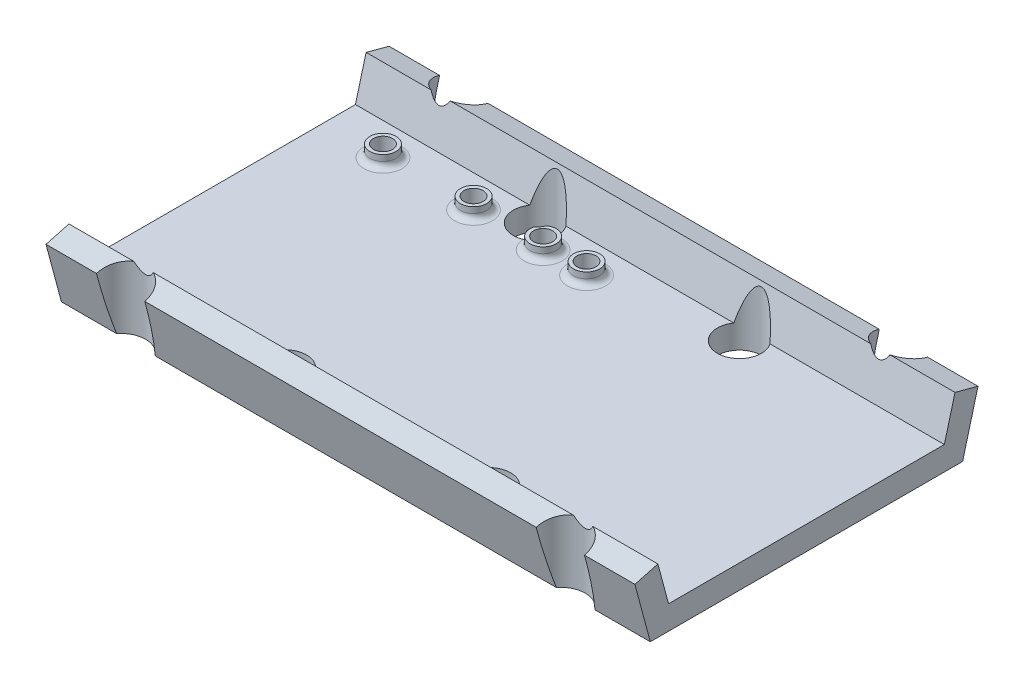
from build123d import *

# Parameters (mm, degrees)
SKETCH2_W                  = 99
SKETCH2_H                  = 52.5
FLATTEMPLATE_DEPTH         = 4
SIDEWALLS_DEPTH            = 99
INNERHOLESCUT_DEPTH        = 58.677621483
INNERHOLESCUT_DEPTH_BACK   = 58.677621483
INNERHOLES_R               = 1
OUTERHOLESCUT_DEPTH        = 58.677621483
OUTERHOLESCUT_DEPTH_BACK   = 58.677621483
TOPOUTERHOLES_R            = 4.064
TARGETHOLES_R              = 2.2
TARGETHOLESUPPORTS_DEPTH   = 2
TARGETHOLEFILLETS_R        = 1
TARGETHOLEHOLES_DEPTH      = 58.677621483
TARGETHOLEHOLES_DEPTH_BACK = 58.677621483
SKETCH10_R                 = 1.6
INNERHOLESRECUT_DEPTH      = 58.677621483
INNERHOLESRECUT_DEPTH_BACK = 58.677621483
SKETCH11_R                 = 3.7


with BuildPart() as part:
    # Sketch2 → FlatTemplate (new body)
    with BuildSketch(Plane(origin=(0, 0, 0), x_dir=(1, 0, 0), z_dir=(0, 1, 0))):
        Rectangle(SKETCH2_W, SKETCH2_H)
    extrude(amount=FLATTEMPLATE_DEPTH)

    # Sketch4 → SideWalls (add, through all)
    with BuildSketch(Plane(origin=(49.5, 0, 0), x_dir=(0, 0, -1), z_dir=(1, 0, 0))):
        Polygon((-26.25, 0), (-28.838190451, 9.659258263), (-24.974487146, 10.694534443), (-22.386296695, 1.03527618), align=None)
        Polygon((26.25, 0), (28.838190451, 9.659258263), (24.974487146, 10.694534443), (22.386296695, 1.03527618), align=None)
    extrude(amount=-SIDEWALLS_DEPTH)

    # InnerHoles → InnerHolesCut (cut, two sides: drawn at the far end of the back side and taken through both)
    with BuildSketch(Plane(origin=(0, 4, 0), x_dir=(1, 0, 0), z_dir=(0, 1, 0)).offset(-INNERHOLESCUT_DEPTH_BACK)):
        with Locations(Location((-17.15, 21.082, 0), (0, 0, 270))):
            Circle(INNERHOLES_R)
        with Locations(Location((17.15, 21.082, 0), (0, 0, 270))):
            Circle(INNERHOLES_R)
        with Locations(Location((17.15, -21.082, 0), (0, 0, 270))):
            Circle(INNERHOLES_R)
        with Locations(Location((-17.15, -21.082, 0), (0, 0, 270))):
            Circle(INNERHOLES_R)
    extrude(amount=INNERHOLESCUT_DEPTH + INNERHOLESCUT_DEPTH_BACK, mode=Mode.SUBTRACT)

    # TopOuterHoles → OuterHolesCut (cut, two sides: drawn at the far end of the back side and taken through both)
    with BuildSketch(Plane(origin=(0, 4, 0), x_dir=(1, 0, 0), z_dir=(0, 1, 0)).offset(-OUTERHOLESCUT_DEPTH_BACK)):
        with Locations((-36.96, 28.7)):
            Circle(TOPOUTERHOLES_R)
        with Locations((36.96, 28.7)):
            Circle(TOPOUTERHOLES_R)
        with Locations((36.96, -28.7)):
            Circle(TOPOUTERHOLES_R)
        with Locations((-36.96, -28.7)):
            Circle(TOPOUTERHOLES_R)
    extrude(amount=OUTERHOLESCUT_DEPTH + OUTERHOLESCUT_DEPTH_BACK, mode=Mode.SUBTRACT)

    # TargetHoles → TargetHoleSupports (add)
    with BuildSketch(Plane(origin=(0, 4, 0), x_dir=(1, 0, 0), z_dir=(0, 1, 0))):
        with Locations(Location((-5.25, 17.782, 0), (0, 0, 90))):
            Circle(TARGETHOLES_R)
        with Locations(Location((-12.55, 17.782, 0), (0, 0, 90))):
            Circle(TARGETHOLES_R)
        with Locations(Location((-24.25, 17.782, 0), (0, 0, 90))):
            Circle(TARGETHOLES_R)
        with Locations(Location((-39.45, 17.757845972, 0), (0, 0, 90))):
            Circle(TARGETHOLES_R)
    extrude(amount=TARGETHOLESUPPORTS_DEPTH)

    # TargetHoleFillets
    targetholefillets_edges = [part.edges().sort_by_distance(p)[0] for p in [
        (-5.25, 4, -15.582),
        (-12.55, 4, -15.582),
        (-24.25, 4, -15.582),
        (-39.45, 4, -15.557845972),
    ]]
    fillet(targetholefillets_edges, radius=TARGETHOLEFILLETS_R)

    # Sketch10 → TargetHoleHoles (cut, two sides: drawn at the far end of the back side and taken through both)
    with BuildSketch(Plane(origin=(0, 4, 0), x_dir=(1, 0, 0), z_dir=(0, 1, 0)).offset(-TARGETHOLEHOLES_DEPTH_BACK)):
        with Locations(Location((-5.25, 17.782, 0), (0, 0, 270))):
            Circle(SKETCH10_R)
        with Locations(Location((-12.55, 17.782, 0), (0, 0, 270))):
            Circle(SKETCH10_R)
        with Locations(Location((-24.25, 17.782, 0), (0, 0, 270))):
            Circle(SKETCH10_R)
        with Locations(Location((-39.45, 17.757845972, 0), (0, 0, 270))):
            Circle(SKETCH10_R)
    extrude(amount=TARGETHOLEHOLES_DEPTH + TARGETHOLEHOLES_DEPTH_BACK, mode=Mode.SUBTRACT)

    # Sketch11 → InnerHolesReCut (cut, two sides: drawn at the far end of the back side and taken through both)
    with BuildSketch(Plane(origin=(0, 4, 0), x_dir=(1, 0, 0), z_dir=(0, 1, 0)).offset(-INNERHOLESRECUT_DEPTH_BACK)):
        with Locations(Location((17.15, 21.082, 0), (0, 0, 270))):
            Circle(SKETCH11_R)
        with Locations(Location((-17.15, 21.082, 0), (0, 0, 270))):
            Circle(SKETCH11_R)
        with Locations(Location((-17.15, -21.082, 0), (0, 0, 270))):
            Circle(SKETCH11_R)
        with Locations(Location((17.15, -21.082, 0), (0, 0, 270))):
            Circle(SKETCH11_R)
    extrude(amount=INNERHOLESRECUT_DEPTH + INNERHOLESRECUT_DEPTH_BACK, mode=Mode.SUBTRACT)


solid = part.part
